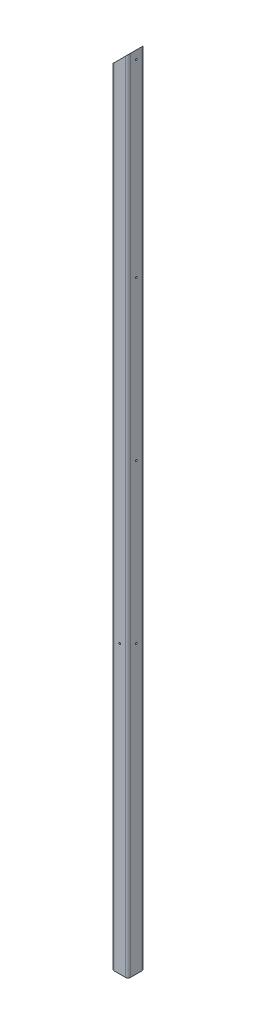
from build123d import *

# Parameters (mm, degrees)
TUBE_SQUARE_40_X_40_X_3_2_1_DEPTH = 1920
CUT_EXTRUDE1_DEPTH                = 1921.52076271
SKETCH16_R                        = 2
CUT_EXTRUDE2_DEPTH                = 3
SKETCH17_R                        = 2
CUT_EXTRUDE3_DEPTH                = 3


with BuildPart() as part:
    # Sketch15 → Tube (square) 40 X 40 X 3.2(1) (new body)
    with BuildSketch(Plane(origin=(0, 0, 0), x_dir=(-1, 0, 0), z_dir=(0, 1, 0))):
        with BuildLine():
            Line((-13.6, -20), (13.6, -20))
            ThreePointArc((13.6, -20), (18.1254834, -18.1254834), (20, -13.6))
            Line((20, -13.6), (20, 13.6))
            ThreePointArc((20, 13.6), (18.1254834, 18.1254834), (13.6, 20))
            Line((13.6, 20), (-13.6, 20))
            ThreePointArc((-13.6, 20), (-18.1254834, 18.1254834), (-20, 13.6))
            Line((-20, 13.6), (-20, -13.6))
            ThreePointArc((-20, -13.6), (-18.1254834, -18.1254834), (-13.6, -20))
        make_face()
        with BuildLine():
            Line((-13.6, -16.8), (13.6, -16.8))
            ThreePointArc((13.6, -16.8), (15.8627417, -15.8627417), (16.8, -13.6))
            Line((16.8, -13.6), (16.8, 13.6))
            ThreePointArc((16.8, 13.6), (15.8627417, 15.8627417), (13.6, 16.8))
            Line((13.6, 16.8), (-13.6, 16.8))
            ThreePointArc((-13.6, 16.8), (-15.8627417, 15.8627417), (-16.8, 13.6))
            Line((-16.8, 13.6), (-16.8, -13.6))
            ThreePointArc((-16.8, -13.6), (-15.8627417, -15.8627417), (-13.6, -16.8))
        make_face(mode=Mode.SUBTRACT)
    extrude(amount=TUBE_SQUARE_40_X_40_X_3_2_1_DEPTH)

    # Sketch13 → Cut-Extrude1 (cut, through all)
    with BuildSketch(Plane(origin=(0, 0, -20), x_dir=(-1, 0, 0), z_dir=(0, 0, -1))):
        Polygon((20, 1880), (-20, 1920), (20, 1920), align=None)
    extrude(amount=-CUT_EXTRUDE1_DEPTH, mode=Mode.SUBTRACT)

    # Sketch16 → Cut-Extrude2 (cut)
    with BuildSketch(Plane(origin=(20, 0, 0), x_dir=(0, 0, -1), z_dir=(1, 0, 0))):
        with Locations((0, 1900)):
            Circle(SKETCH16_R)
        with Locations((0, 1447)):
            Circle(SKETCH16_R)
        with Locations((0, 1067)):
            Circle(SKETCH16_R)
        with Locations((0, 687)):
            Circle(SKETCH16_R)
    extrude(amount=-CUT_EXTRUDE2_DEPTH, mode=Mode.SUBTRACT)

    # Sketch17 → Cut-Extrude3 (cut)
    with BuildSketch(Plane.XY.offset(20)):
        with Locations((0, 687)):
            Circle(SKETCH17_R)
    extrude(amount=-CUT_EXTRUDE3_DEPTH, mode=Mode.SUBTRACT)


solid = part.part
